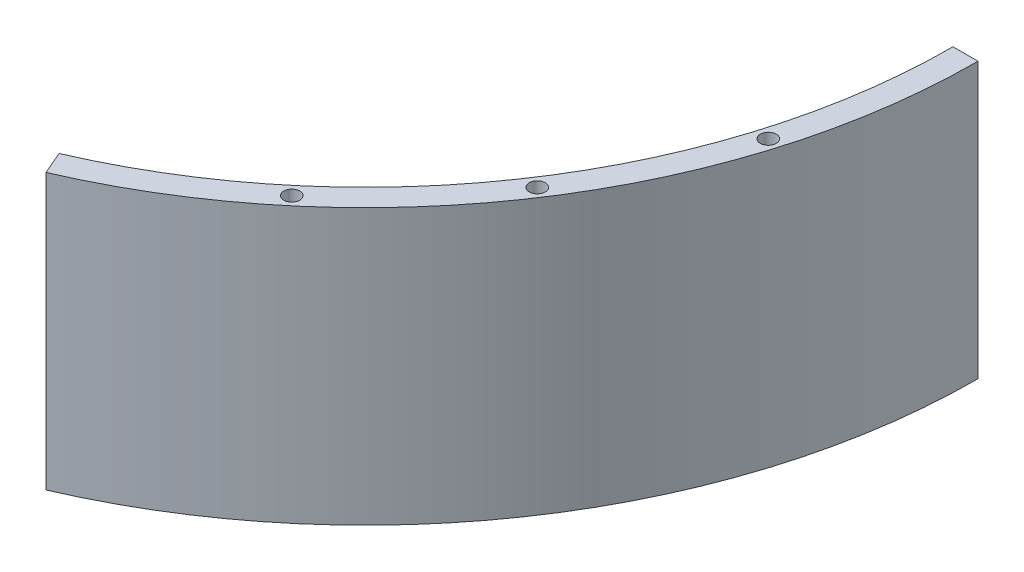
from build123d import *

# Parameters (mm, degrees)
EXTRUDE_1_DEPTH     = 55
SKETCH_3_R          = 1.6
CUT_EXTRUDE_1_DEPTH = 10


with BuildPart() as part:
    # ｽｹｯﾁ1 → ﾎﾞｽ - 押し出し1 (new body)
    with BuildSketch(Plane(origin=(0, 0, 0), x_dir=(1, 0, 0), z_dir=(0, 1, 0))):
        with BuildLine():
            Line((117.5, 0), (122.5, 0))
            ThreePointArc((122.5, 0), (102.362919004, -67.291030703), (48.572117338, -112.458878784))
            Line((48.572117338, -112.458878784), (46.589581936, -107.868720466))
            ThreePointArc((46.589581936, -107.868720466), (98.184840677, -64.544458021), (117.5, 0))
        make_face()
    extrude(amount=EXTRUDE_1_DEPTH)

    # ｽｹｯﾁ3 → ｶｯﾄ - 押し出し1 (cut)
    with BuildSketch(Plane(origin=(0, 55, 0), x_dir=(1, 0, 0), z_dir=(0, 1, 0))):
        with Locations(Location((77.166596457, -91.89840255, 0), (0, 0, 270))):
            Circle(SKETCH_3_R)
        with Locations(Location((100.27387984, -65.917744362, 0), (0, 0, 270))):
            Circle(SKETCH_3_R)
        with Locations(Location((114.962745228, -34.403011635, 0), (0, 0, 270))):
            Circle(SKETCH_3_R)
    extrude(amount=-CUT_EXTRUDE_1_DEPTH, mode=Mode.SUBTRACT)


solid = part.part
